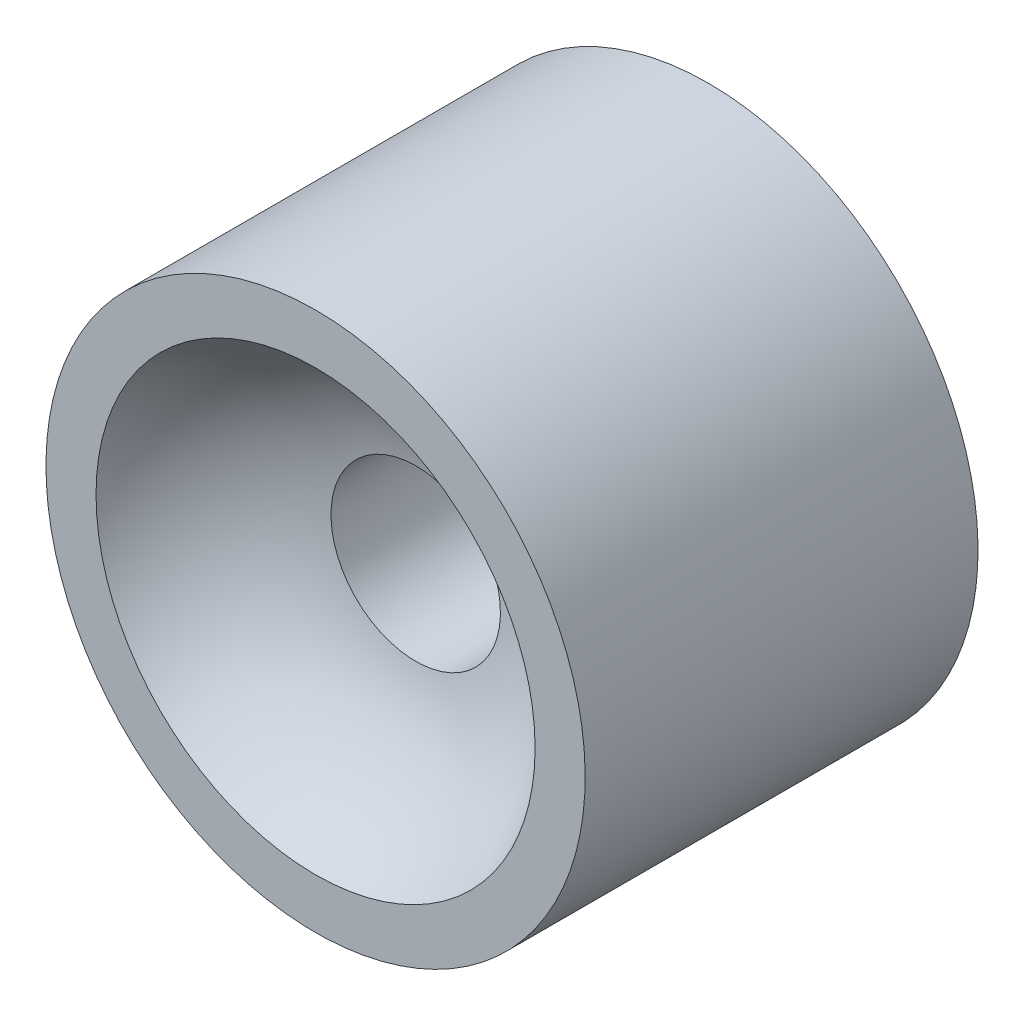
from build123d import *


with BuildPart() as part:
    # Sketch2 → Revolve1 (revolve)
    with BuildSketch(Plane(origin=(0, 0, 0), x_dir=(0, 0, -1), z_dir=(1, 0, 0))):
        with BuildLine():
            Line((-25.5, 35), (25.5, 35))
            Line((25.5, 35), (25.5, 28.5))
            ThreePointArc((25.5, 28.5), (16.992025424, 21.241638257), (12.5, 11))
            Line((12.5, 11), (-12.5, 11))
            ThreePointArc((-12.5, 11), (-16.992025424, 21.241638257), (-25.5, 28.5))
            Line((-25.5, 28.5), (-25.5, 35))
        make_face()
    revolve(axis=Axis((0, 0, -12.5), (0, 0, 1)))


solid = part.part
